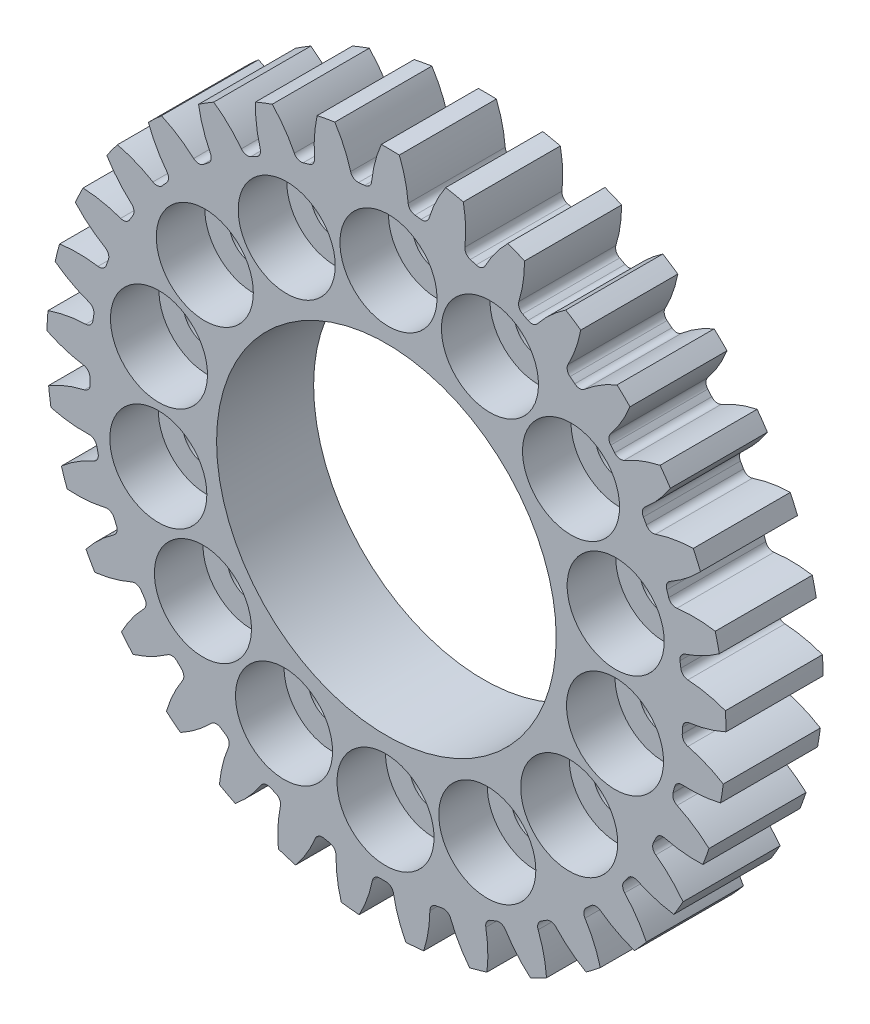
from build123d import *

# Parameters (mm, degrees)
SKETCH3_R               = 44.45
GEARBODY_DEPTH          = 12.7
TOOTHCUT_DEPTH          = 65.131856359
CIRPATTERN1_COUNT       = 33
BOREDIA_R               = 22.225
BORE_DEPTH              = 12700
CUT_EXTRUDE1_DEPTH      = 65.130447181
CUT_EXTRUDE1_DEPTH_BACK = 65.130447181
SKETCH4_R               = 3.175
SKETCH7_R               = 6.35
CUT_EXTRUDE2_DEPTH      = 6.35


with BuildPart() as part:
    # Sketch3 → gearBody (new body)
    with BuildSketch(Plane.XY):
        Circle(SKETCH3_R)
    extrude(amount=GEARBODY_DEPTH)

    # Sketch2 → toothCut (cut, through all)
    with BuildSketch(Plane.XY):
        with BuildLine():
            ThreePointArc((38.717519537, -2.694981698), (38.74332094, -2.294412341), (38.764978185, -1.893597563))
            ThreePointArc((38.764978185, -1.893597563), (39.025144117, -1.273240744), (39.622723336, -0.964326561))
            ThreePointArc((39.622723336, -0.964326561), (46.185808246, 1.354812907), (51.224689902, 6.157121004))
            ThreePointArc((51.224689902, 6.157121004), (51.503166129, -3.0500612), (50.139933269, -12.160019999))
            ThreePointArc((50.139933269, -12.160019999), (45.703077577, -6.796550695), (39.459589527, -3.71899511))
            ThreePointArc((39.459589527, -3.71899511), (38.902647659, -3.341709209), (38.717519537, -2.694981698))
        make_face()
    toothcut = extrude(amount=TOOTHCUT_DEPTH, mode=Mode.SUBTRACT)

    # CirPattern1: toothCut ×33 about axis
    cirpattern1_axis = Axis((0, 0, 0), (0, 0, 1))
    for i in range(1, CIRPATTERN1_COUNT):
        add(toothcut.rotate(cirpattern1_axis, i * 360 / CIRPATTERN1_COUNT), mode=Mode.SUBTRACT)

    # boreDia → bore (cut, symmetric)
    with BuildSketch(Plane.XY):
        Circle(BOREDIA_R)
    extrude(amount=BORE_DEPTH, both=True, mode=Mode.SUBTRACT)

    # Sketch4 → Cut-Extrude1 (cut, two sides: drawn at the far end of the back side and taken through both)
    with BuildSketch(Plane(origin=(0, 0, 0), x_dir=(-1, 0, 0), z_dir=(0, 0, -1)).offset(-CUT_EXTRUDE1_DEPTH_BACK)):
        with Locations((-29.919632214, -7.028112421)):
            Circle(SKETCH4_R)
        with Locations((-30.00581232, 6.613355847)):
            Circle(SKETCH4_R)
        with Locations((-24.164646654, 18.941286216)):
            Circle(SKETCH4_R)
        with Locations((-13.553049713, 27.513980884)):
            Circle(SKETCH4_R)
        with Locations((-0.272778413, 30.633512535)):
            Circle(SKETCH4_R)
        with Locations((13.045846643, 27.682019667)):
            Circle(SKETCH4_R)
        with Locations((23.764908419, 19.24408164)):
            Circle(SKETCH4_R)
        with Locations((29.761365272, 6.990935565)):
            Circle(SKETCH4_R)
        with Locations((29.847545379, -6.650532703)):
            Circle(SKETCH4_R)
        with Locations((24.006379712, -18.978463072)):
            Circle(SKETCH4_R)
        with Locations((13.394782771, -27.55115774)):
            Circle(SKETCH4_R)
        with Locations((0.114511471, -30.670689391)):
            Circle(SKETCH4_R)
        with Locations((-13.204113584, -27.719196523)):
            Circle(SKETCH4_R)
        with Locations((-23.923175361, -19.281258496)):
            Circle(SKETCH4_R)
    extrude(amount=CUT_EXTRUDE1_DEPTH + CUT_EXTRUDE1_DEPTH_BACK, mode=Mode.SUBTRACT)

    # Sketch7 → Cut-Extrude2 (cut)
    with BuildSketch(Plane.XY.offset(12.7)):
        with Locations((-29.761365272, 6.990935565)):
            Circle(SKETCH7_R)
        with Locations((-23.764908419, 19.24408164)):
            Circle(SKETCH7_R)
        with Locations((-13.045846643, 27.682019667)):
            Circle(SKETCH7_R)
        with Locations((0.272778413, 30.633512535)):
            Circle(SKETCH7_R)
        with Locations((13.553049713, 27.513980884)):
            Circle(SKETCH7_R)
        with Locations((24.164646654, 18.941286216)):
            Circle(SKETCH7_R)
        with Locations((30.00581232, 6.613355847)):
            Circle(SKETCH7_R)
        with Locations((29.919632214, -7.028112421)):
            Circle(SKETCH7_R)
        with Locations((23.923175361, -19.281258496)):
            Circle(SKETCH7_R)
        with Locations((13.204113584, -27.719196523)):
            Circle(SKETCH7_R)
        with Locations((-0.114511471, -30.670689391)):
            Circle(SKETCH7_R)
        with Locations((-13.394782771, -27.55115774)):
            Circle(SKETCH7_R)
        with Locations((-24.006379712, -18.978463072)):
            Circle(SKETCH7_R)
        with Locations((-29.847545379, -6.650532703)):
            Circle(SKETCH7_R)
    extrude(amount=-CUT_EXTRUDE2_DEPTH, mode=Mode.SUBTRACT)


solid = part.part
